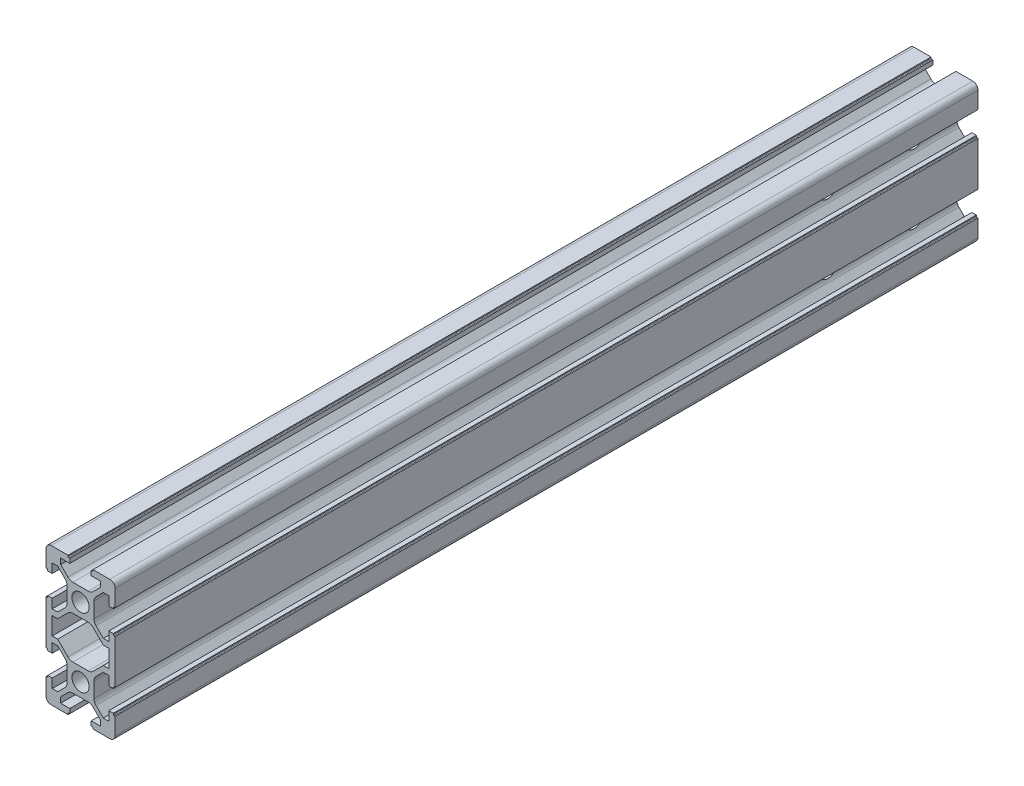
from build123d import *

# Parameters (mm, degrees)
CROQUIS3_R              = 2.5
SALIENTE_EXTRUIR3_DEPTH = 175
SKETCH1_W               = 20
SKETCH1_H               = 100
CUT_EXTRUDE3_DEPTH      = 90
F_6_0MM_DOWEL_HOLE1_D   = 6


with BuildPart() as part:
    # Croquis3 → Saliente-Extruir3 (new, symmetric)
    with BuildSketch(Plane.XY):
        with BuildLine():
            Line((-9.5, -13.101470971), (-9.5, -13.401470971))
            ThreePointArc((-9.5, -13.401470971), (-9.558578644, -13.542892327), (-9.7, -13.601470971))
            Line((-9.7, -13.601470971), (-10, -13.601470971))
            Line((-10, -13.601470971), (-10, -18.5))
            ThreePointArc((-10, -18.5), (-9.560660172, -19.560660172), (-8.5, -20))
            Line((-8.5, -20), (-3.601470971, -20))
            Line((-3.601470971, -20), (-3.601470971, -19.7))
            ThreePointArc((-3.601470971, -19.7), (-3.542892327, -19.558578644), (-3.401470971, -19.5))
            Line((-3.401470971, -19.5), (-3.101470971, -19.5))
            Line((-3.101470971, -19.5), (-3.101470971, -18.2))
            Line((-3.101470971, -18.2), (-5.751470971, -18.2))
            Line((-5.751470971, -18.2), (-5.751470971, -16.6))
            Line((-5.751470971, -16.6), (-3.637257409, -14.485786438))
            ThreePointArc((-3.637257409, -14.485786438), (-2.988410711, -14.052240935), (-2.223043846, -13.9))
            Line((-2.223043846, -13.9), (2.223043846, -13.9))
            ThreePointArc((2.223043846, -13.9), (2.988410711, -14.052240935), (3.637257409, -14.485786438))
            Line((3.637257409, -14.485786438), (5.751470971, -16.6))
            Line((5.751470971, -16.6), (5.751470971, -18.2))
            Line((5.751470971, -18.2), (3.101470971, -18.2))
            Line((3.101470971, -18.2), (3.101470971, -19.5))
            Line((3.101470971, -19.5), (3.401470971, -19.5))
            ThreePointArc((3.401470971, -19.5), (3.542892327, -19.558578644), (3.601470971, -19.7))
            Line((3.601470971, -19.7), (3.601470971, -20))
            Line((3.601470971, -20), (8.5, -20))
            ThreePointArc((8.5, -20), (9.560660172, -19.560660172), (10, -18.5))
            Line((10, -18.5), (10, -13.601470971))
            Line((10, -13.601470971), (9.7, -13.601470971))
            ThreePointArc((9.7, -13.601470971), (9.558578644, -13.542892327), (9.5, -13.401470971))
            Line((9.5, -13.401470971), (9.5, -13.101470971))
            Line((9.5, -13.101470971), (8.2, -13.101470971))
            Line((8.2, -13.101470971), (8.2, -15.751470971))
            Line((8.2, -15.751470971), (6.6, -15.751470971))
            Line((6.6, -15.751470971), (4.485786438, -13.637257409))
            ThreePointArc((4.485786438, -13.637257409), (4.052240935, -12.988410711), (3.9, -12.223043846))
            Line((3.9, -12.223043846), (3.9, -7.776956154))
            ThreePointArc((3.9, -7.776956154), (4.052507548, -7.010945946), (4.486771639, -6.361758076))
            Line((4.486771639, -6.361758076), (6.6, -4.251470971))
            Line((6.6, -4.251470971), (8.2, -4.251470971))
            Line((8.2, -4.251470971), (8.2, -6.901470971))
            Line((8.2, -6.901470971), (9.5, -6.901470971))
            Line((9.5, -6.901470971), (9.5, -6.601470971))
            ThreePointArc((9.5, -6.601470971), (9.558578644, -6.460049615), (9.7, -6.401470971))
            Line((9.7, -6.401470971), (10, -6.401470971))
            Line((10, -6.401470971), (10, 6.401470971))
            Line((10, 6.401470971), (9.7, 6.401470971))
            ThreePointArc((9.7, 6.401470971), (9.558578644, 6.460049615), (9.5, 6.601470971))
            Line((9.5, 6.601470971), (9.5, 6.901470971))
            Line((9.5, 6.901470971), (8.2, 6.901470971))
            Line((8.2, 6.901470971), (8.2, 4.251470971))
            Line((8.2, 4.251470971), (6.6, 4.251470971))
            Line((6.6, 4.251470971), (4.486771639, 6.361758076))
            ThreePointArc((4.486771639, 6.361758076), (4.052507548, 7.010945946), (3.9, 7.776956154))
            Line((3.9, 7.776956154), (3.9, 12.223043846))
            ThreePointArc((3.9, 12.223043846), (4.052240935, 12.988410711), (4.485786438, 13.637257409))
            Line((4.485786438, 13.637257409), (6.6, 15.751470971))
            Line((6.6, 15.751470971), (8.2, 15.751470971))
            Line((8.2, 15.751470971), (8.2, 13.101470971))
            Line((8.2, 13.101470971), (9.5, 13.101470971))
            Line((9.5, 13.101470971), (9.5, 13.401470971))
            ThreePointArc((9.5, 13.401470971), (9.558578644, 13.542892327), (9.7, 13.601470971))
            Line((9.7, 13.601470971), (10, 13.601470971))
            Line((10, 13.601470971), (10, 18.5))
            ThreePointArc((10, 18.5), (9.560660172, 19.560660172), (8.5, 20))
            Line((8.5, 20), (3.601470971, 20))
            Line((3.601470971, 20), (3.601470971, 19.7))
            ThreePointArc((3.601470971, 19.7), (3.542892327, 19.558578644), (3.401470971, 19.5))
            Line((3.401470971, 19.5), (3.101470971, 19.5))
            Line((3.101470971, 19.5), (3.101470971, 18.2))
            Line((3.101470971, 18.2), (5.751470971, 18.2))
            Line((5.751470971, 18.2), (5.751470971, 16.6))
            Line((5.751470971, 16.6), (3.637257409, 14.485786438))
            ThreePointArc((3.637257409, 14.485786438), (2.988410711, 14.052240935), (2.223043846, 13.9))
            Line((2.223043846, 13.9), (-2.223043846, 13.9))
            ThreePointArc((-2.223043846, 13.9), (-2.988410711, 14.052240935), (-3.637257409, 14.485786438))
            Line((-3.637257409, 14.485786438), (-5.751470971, 16.6))
            Line((-5.751470971, 16.6), (-5.751470971, 18.2))
            Line((-5.751470971, 18.2), (-3.101470971, 18.2))
            Line((-3.101470971, 18.2), (-3.101470971, 19.5))
            Line((-3.101470971, 19.5), (-3.401470971, 19.5))
            ThreePointArc((-3.401470971, 19.5), (-3.542892327, 19.558578644), (-3.601470971, 19.7))
            Line((-3.601470971, 19.7), (-3.601470971, 20))
            Line((-3.601470971, 20), (-8.5, 20))
            ThreePointArc((-8.5, 20), (-9.560660172, 19.560660172), (-10, 18.5))
            Line((-10, 18.5), (-10, 13.601470971))
            Line((-10, 13.601470971), (-9.7, 13.601470971))
            ThreePointArc((-9.7, 13.601470971), (-9.558578644, 13.542892327), (-9.5, 13.401470971))
            Line((-9.5, 13.401470971), (-9.5, 13.101470971))
            Line((-9.5, 13.101470971), (-8.2, 13.101470971))
            Line((-8.2, 13.101470971), (-8.2, 15.751470971))
            Line((-8.2, 15.751470971), (-6.6, 15.751470971))
            Line((-6.6, 15.751470971), (-4.485786438, 13.637257409))
            ThreePointArc((-4.485786438, 13.637257409), (-4.052240935, 12.988410711), (-3.9, 12.223043846))
            Line((-3.9, 12.223043846), (-3.9, 7.776956154))
            ThreePointArc((-3.9, 7.776956154), (-4.052507548, 7.010945946), (-4.486771639, 6.361758076))
            Line((-4.486771639, 6.361758076), (-6.6, 4.251470971))
            Line((-6.6, 4.251470971), (-8.2, 4.251470971))
            Line((-8.2, 4.251470971), (-8.2, 6.901470971))
            Line((-8.2, 6.901470971), (-9.5, 6.901470971))
            Line((-9.5, 6.901470971), (-9.5, 6.601470971))
            ThreePointArc((-9.5, 6.601470971), (-9.558578644, 6.460049615), (-9.7, 6.401470971))
            Line((-9.7, 6.401470971), (-10, 6.401470971))
            Line((-10, 6.401470971), (-10, -6.401470971))
            Line((-10, -6.401470971), (-9.7, -6.401470971))
            ThreePointArc((-9.7, -6.401470971), (-9.558578644, -6.460049615), (-9.5, -6.601470971))
            Line((-9.5, -6.601470971), (-9.5, -6.901470971))
            Line((-9.5, -6.901470971), (-8.2, -6.901470971))
            Line((-8.2, -6.901470971), (-8.2, -4.251470971))
            Line((-8.2, -4.251470971), (-6.6, -4.251470971))
            Line((-6.6, -4.251470971), (-4.486771639, -6.361758076))
            ThreePointArc((-4.486771639, -6.361758076), (-4.052507548, -7.010945946), (-3.9, -7.776956154))
            Line((-3.9, -7.776956154), (-3.9, -12.223043846))
            ThreePointArc((-3.9, -12.223043846), (-4.052240935, -12.988410711), (-4.485786438, -13.637257409))
            Line((-4.485786438, -13.637257409), (-6.6, -15.751470971))
            Line((-6.6, -15.751470971), (-8.2, -15.751470971))
            Line((-8.2, -15.751470971), (-8.2, -13.101470971))
            Line((-8.2, -13.101470971), (-9.5, -13.101470971))
        make_face()
        with Locations((0, -10)):
            Circle(CROQUIS3_R, mode=Mode.SUBTRACT)
        with Locations(Location((0, 10, 0), (0, 0, 180))):
            Circle(CROQUIS3_R, mode=Mode.SUBTRACT)
        with BuildLine():
            Line((-3.636272208, -5.515198077), (-6.6, -2.555595292))
            Line((-6.6, -2.555595292), (-8.2, -2.555595292))
            Line((-8.2, -2.555595292), (-8.2, 2.555595292))
            Line((-8.2, 2.555595292), (-6.6, 2.555595292))
            Line((-6.6, 2.555595292), (-3.636272208, 5.515198077))
            ThreePointArc((-3.636272208, 5.515198077), (-2.987767275, 5.948025454), (-2.223043846, 6.1))
            Line((-2.223043846, 6.1), (2.223043846, 6.1))
            ThreePointArc((2.223043846, 6.1), (2.987767275, 5.948025454), (3.636272208, 5.515198077))
            Line((3.636272208, 5.515198077), (6.6, 2.555595292))
            Line((6.6, 2.555595292), (8.2, 2.555595292))
            Line((8.2, 2.555595292), (8.2, -2.555595292))
            Line((8.2, -2.555595292), (6.6, -2.555595292))
            Line((6.6, -2.555595292), (3.636272208, -5.515198077))
            ThreePointArc((3.636272208, -5.515198077), (2.987767275, -5.948025454), (2.223043846, -6.1))
            Line((2.223043846, -6.1), (-2.223043846, -6.1))
            ThreePointArc((-2.223043846, -6.1), (-2.987767275, -5.948025454), (-3.636272208, -5.515198077))
        make_face(mode=Mode.SUBTRACT)
    extrude(amount=SALIENTE_EXTRUIR3_DEPTH, both=True)

    # Sketch1 → Cut-Extrude3 (cut)
    with BuildSketch(Plane(origin=(0, 20, 0), x_dir=(1, 0, 0), z_dir=(0, 1, 0))):
        with Locations((0, -125)):
            Rectangle(SKETCH1_W, SKETCH1_H)
    extrude(amount=-CUT_EXTRUDE3_DEPTH, mode=Mode.SUBTRACT)

    # Ø6.0mm Dowel Hole1 (through all)
    with Locations(Plane(origin=(10, 0, 0), x_dir=(0, 0, -1), z_dir=(1, 0, 0))):
        with Locations((137.5, -10), (137.5, 10), (162.5, 10), (162.5, -10)):
            Hole(F_6_0MM_DOWEL_HOLE1_D / 2)


solid = part.part
